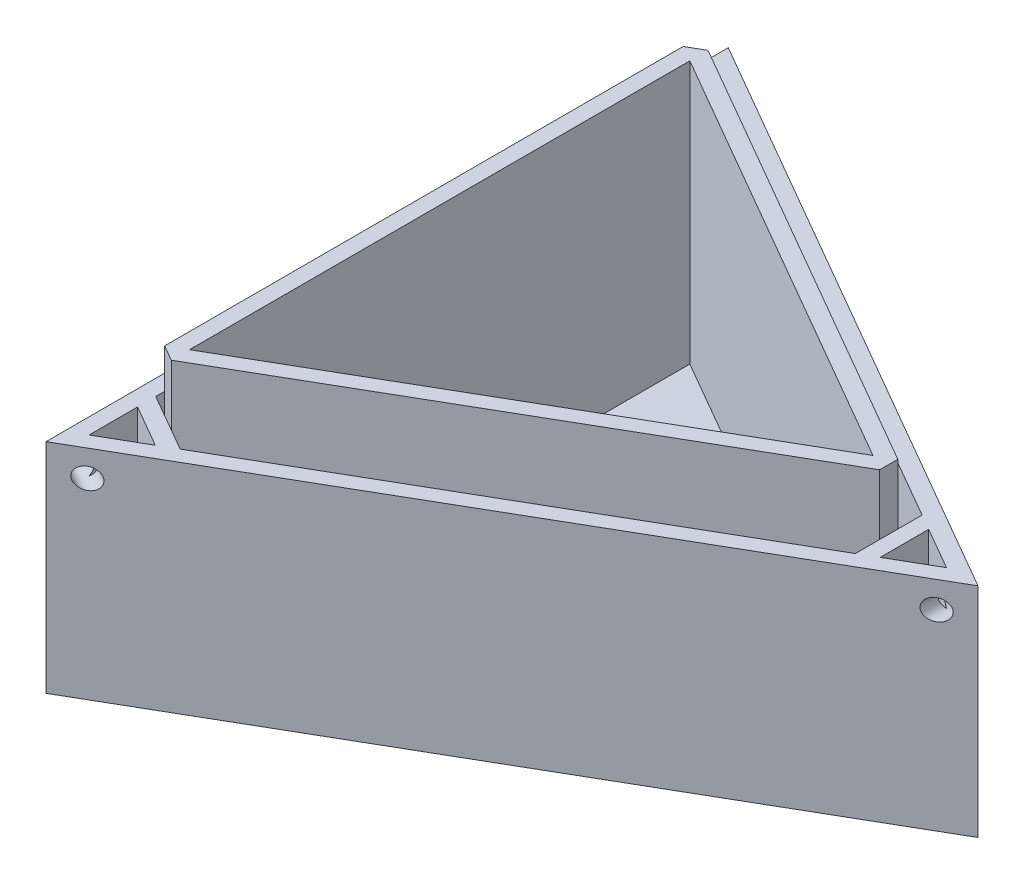
from build123d import *

# Parameters (mm, degrees)
SKETCH1_R               = 1.225
SKETCH1_R_2             = 9
BOSS_EXTRUDE1_DEPTH     = 3
BOSS_EXTRUDE2_DEPTH     = 38.5
BOSS_EXTRUDE4_DEPTH     = 50
SKETCH2_R               = 2
CUT_EXTRUDE1_DEPTH      = 5
MIRROR2_COPY_1_SKETCH_R = 2
MIRROR2_COPY_1_DEPTH    = 5
MIRROR2_COPY_2_SKETCH_R = 2
MIRROR2_COPY_2_DEPTH    = 5


with BuildPart() as part:
    # Sketch1 → Boss-Extrude1 (new body)
    with BuildSketch(Plane(origin=(0, 0, 0), x_dir=(1, 0, 0), z_dir=(0, 1, 0))):
        Polygon((-37.5, -64.951905284), (75, 0), (-37.5, 64.951905284), align=None)
        with Locations((-13.95, 13.95)):
            Circle(SKETCH1_R, mode=Mode.SUBTRACT)
        Circle(SKETCH1_R_2, mode=Mode.SUBTRACT)
        with Locations((13.95, 13.95)):
            Circle(SKETCH1_R, mode=Mode.SUBTRACT)
        with Locations((-13.95, -13.95)):
            Circle(SKETCH1_R, mode=Mode.SUBTRACT)
        with Locations((13.95, -13.95)):
            Circle(SKETCH1_R, mode=Mode.SUBTRACT)
    extrude(amount=-BOSS_EXTRUDE1_DEPTH)

    # Sketch1<3> → Boss-Extrude2 (add)
    with BuildSketch(Plane(origin=(0, 0, 0), x_dir=(1, 0, 0), z_dir=(0, 1, 0))):
        Polygon((-37.5, -64.951905284), (75, 0), (-37.5, 64.951905284), align=None)
        Polygon((-34.5, 50.518148554), (-34.5, 59.755752861), (-26.5, 55.136950708), align=None, mode=Mode.SUBTRACT)
        Polygon((-34.5, 47.054046939), (-23.5, 53.4048999), (58, 6.350852961), (58, -6.350852961), (-23.5, -53.4048999), (-34.5, -47.054046939), align=None, mode=Mode.SUBTRACT)
        Polygon((-34.5, -59.755752861), (-34.5, -50.518148554), (-26.5, -55.136950708), align=None, mode=Mode.SUBTRACT)
        Polygon((69, 0), (61, -4.618802154), (61, 4.618802154), align=None, mode=Mode.SUBTRACT)
    extrude(amount=BOSS_EXTRUDE2_DEPTH)

    # Sketch1<5> → Boss-Extrude4 (add)
    with BuildSketch(Plane(origin=(0, 0, 0), x_dir=(1, 0, 0), z_dir=(0, 1, 0))):
        Polygon((58, 1.732050808), (-27.5, 51.095498823), (-30.5, 49.363448016), (-30.5, -49.363448016), (-27.5, -51.095498823), (58, -1.732050808), align=None)
        Polygon((-27.5, 47.631397208), (55, 0), (-27.5, -47.631397208), align=None, mode=Mode.SUBTRACT)
    extrude(amount=BOSS_EXTRUDE4_DEPTH)

    # Sketch2 → Cut-Extrude1 (cut, symmetric)
    with BuildSketch(Plane(origin=(-5.024047358, 0, 8.701905284), x_dir=(0.4999999999999999, 0, -0.8660254037844386), z_dir=(0.8660254037844387, 0, 0.49999999999999994))):
        with Locations((-59.951905284, 33.5)):
            Circle(SKETCH2_R)
    cut_extrude1 = extrude(amount=CUT_EXTRUDE1_DEPTH, both=True, mode=Mode.SUBTRACT)

    # Mirror1: Cut-Extrude1 across plane
    add(cut_extrude1.mirror(Plane(origin=(0, 0, 0), x_dir=(0.5000000000000001, 0, 0.8660254037844387), z_dir=(-0.8660254037844388, 0, 0.49999999999999994))), mode=Mode.SUBTRACT)

    # Mirror2 copy 1 sketch → Mirror2 copy 1 (cut, symmetric)
    with BuildSketch(Plane(origin=(10.048094716, 0, 0), x_dir=(-1, 0, 0), z_dir=(0, 0, -1))):
        with Locations((-59.951905284, 33.5)):
            Circle(MIRROR2_COPY_1_SKETCH_R)
    extrude(amount=MIRROR2_COPY_1_DEPTH, both=True, mode=Mode.SUBTRACT)

    # Mirror2 copy 2 sketch → Mirror2 copy 2 (cut, symmetric)
    with BuildSketch(Plane(origin=(-5.024047358, 0, -8.701905284), x_dir=(0.4999999999999999, 0, 0.8660254037844386), z_dir=(0.8660254037844387, 0, -0.49999999999999994))):
        with Locations((-59.951905284, -33.5)):
            Circle(MIRROR2_COPY_2_SKETCH_R)
    extrude(amount=MIRROR2_COPY_2_DEPTH, both=True, mode=Mode.SUBTRACT)


solid = part.part
